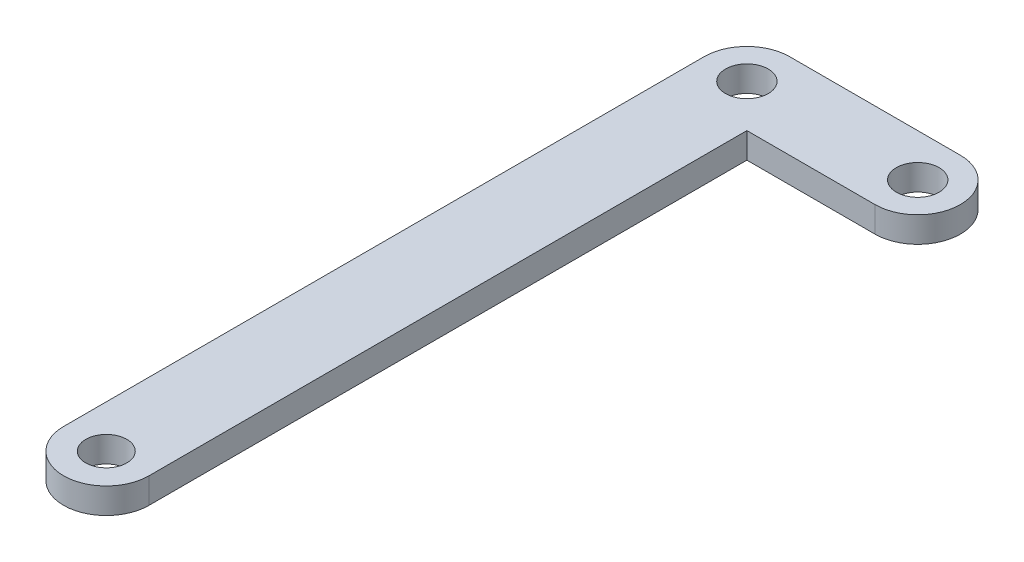
from build123d import *

# Parameters (mm, degrees)
SKETCH1_R           = 2.4
SKETCH1_R_2         = 2.5
BOSS_EXTRUDE1_DEPTH = 3


with BuildPart() as part:
    # Sketch1 → Boss-Extrude1 (new body)
    # profile 1 of 4: a face of its own
    with BuildSketch(Plane(origin=(0, 0, 0), x_dir=(1, 0, 0), z_dir=(0, 1, 0))):
        with BuildLine():
            Line((19.068769591, 26.574235382), (19.068769591, -48.425764618))
            ThreePointArc((19.068769591, -48.425764618), (24.068769591, -53.425764618), (29.068769591, -48.425764618))
            Line((29.068769591, -48.425764618), (29.068769591, 21.574235382))
            Line((29.068769591, 21.574235382), (24.068769591, 21.574235382))
            Line((24.068769591, 21.574235382), (24.068769591, 24.074235382))
            ThreePointArc((24.068769591, 24.074235382), (22.301002638, 24.806468429), (21.568769591, 26.574235382))
            Line((21.568769591, 26.574235382), (19.068769591, 26.574235382))
        make_face()
        with Locations(Location((24.068769591, -48.425764618, 0), (0, 0, 270))):
            Circle(SKETCH1_R, mode=Mode.SUBTRACT)
    # profile 2 of 4: a face of its own
    with BuildSketch(Plane(origin=(0, 0, 0), x_dir=(1, 0, 0), z_dir=(0, 1, 0))):
        with BuildLine():
            Line((44.068769591, 31.574235382), (24.068769591, 31.574235382))
            Line((24.068769591, 31.574235382), (24.068769591, 29.074235382))
            ThreePointArc((24.068769591, 29.074235382), (25.836536544, 28.342002335), (26.568769591, 26.574235382))
            Line((26.568769591, 26.574235382), (29.068769591, 26.574235382))
            Line((29.068769591, 26.574235382), (29.068769591, 21.574235382))
            Line((29.068769591, 21.574235382), (44.068769591, 21.574235382))
            ThreePointArc((44.068769591, 21.574235382), (49.068769591, 26.574235382), (44.068769591, 31.574235382))
        make_face()
        with Locations(Location((44.068769591, 26.574235382, 0), (0, 0, 270))):
            Circle(SKETCH1_R_2, mode=Mode.SUBTRACT)
    # profile 3 of 4: a face of its own
    with BuildSketch(Plane(origin=(0, 0, 0), x_dir=(1, 0, 0), z_dir=(0, 1, 0))):
        with BuildLine():
            Line((24.068769591, 21.574235382), (29.068769591, 21.574235382))
            Line((29.068769591, 21.574235382), (29.068769591, 26.574235382))
            Line((29.068769591, 26.574235382), (26.568769591, 26.574235382))
            ThreePointArc((26.568769591, 26.574235382), (25.836536544, 24.806468429), (24.068769591, 24.074235382))
            Line((24.068769591, 24.074235382), (24.068769591, 21.574235382))
        make_face()
    # profile 4 of 4: a face of its own
    with BuildSketch(Plane(origin=(0, 0, 0), x_dir=(1, 0, 0), z_dir=(0, 1, 0))):
        with BuildLine():
            ThreePointArc((24.068769591, 31.574235382), (20.533235685, 30.109769288), (19.068769591, 26.574235382))
            Line((19.068769591, 26.574235382), (21.568769591, 26.574235382))
            ThreePointArc((21.568769591, 26.574235382), (22.301002638, 28.342002335), (24.068769591, 29.074235382))
            Line((24.068769591, 29.074235382), (24.068769591, 31.574235382))
        make_face()
    extrude(amount=BOSS_EXTRUDE1_DEPTH)


solid = part.part
